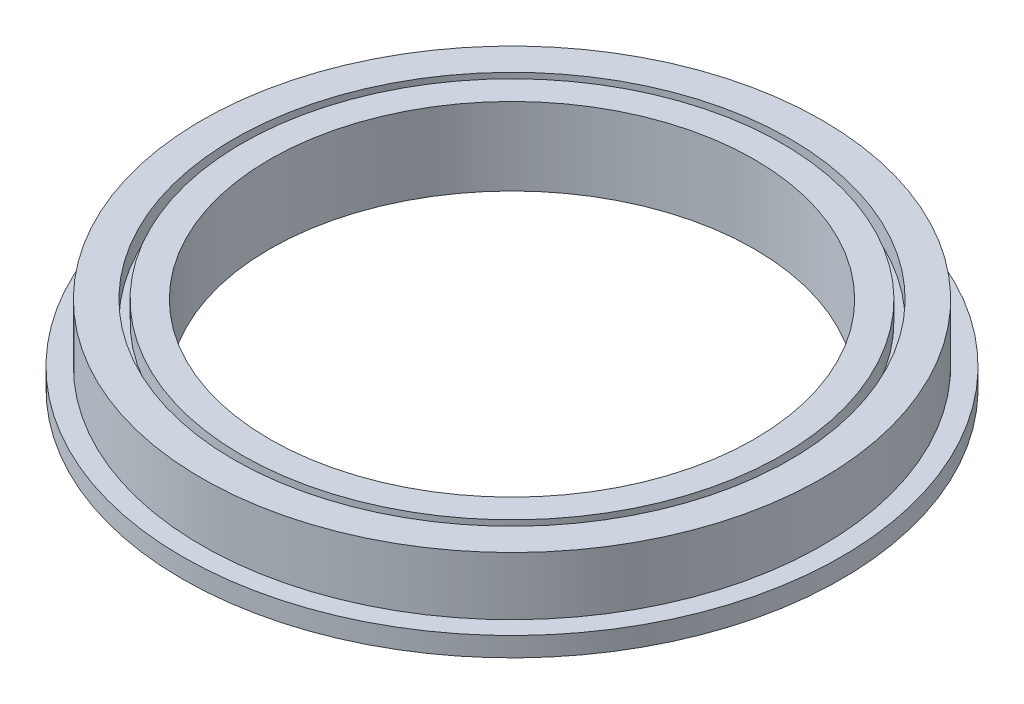
from build123d import *

# Parameters (mm, degrees)
SKETCH_1_W          = 3.5
SKETCH_1_H          = 3
EXTRUDE_START       = 1
SKETCH_2_R          = 17
SKETCH_2_R_2        = 12.5
EXTRUDE_1_DEPTH     = 1
SKETCH_3_R          = 14.340356903
SKETCH_3_R_2        = 13.93231215
CUT_EXTRUDE_1_DEPTH = 1


with BuildPart() as part:
    # 草图1 → 旋转1 (revolve)
    with BuildSketch(Plane.XY, mode=Mode.PRIVATE) as revolve_1_sk:
        with Locations((14.25, 1.5)):
            Rectangle(SKETCH_1_W, SKETCH_1_H)
    revolve(revolve_1_sk.sketch.rotate(Axis((0, 0, 0), (0, 1, 0)), 90), axis=Axis((0, 0, 0), (0, 1, 0)))

    # 草图2 → 凸台-拉伸1 (add)
    with BuildSketch(Plane.XZ.offset(EXTRUDE_START)):
        with Locations(Location((0, 0, 0), (0, 0, 270))):
            Circle(SKETCH_2_R)
        with Locations(Location((0, 0, 0), (0, 0, 270))):
            Circle(SKETCH_2_R_2, mode=Mode.SUBTRACT)
    extrude(amount=-EXTRUDE_1_DEPTH)

    # 草图3 → 切除-拉伸1 (cut)
    with BuildSketch(Plane(origin=(0, 3, 0), x_dir=(1, 0, 0), z_dir=(0, 1, 0))):
        with Locations(Location((0, 0, 0), (0, 0, 270))):
            Circle(SKETCH_3_R)
        with Locations(Location((0, 0, 0), (0, 0, 270))):
            Circle(SKETCH_3_R_2, mode=Mode.SUBTRACT)
    extrude(amount=-CUT_EXTRUDE_1_DEPTH, mode=Mode.SUBTRACT)


solid = part.part
